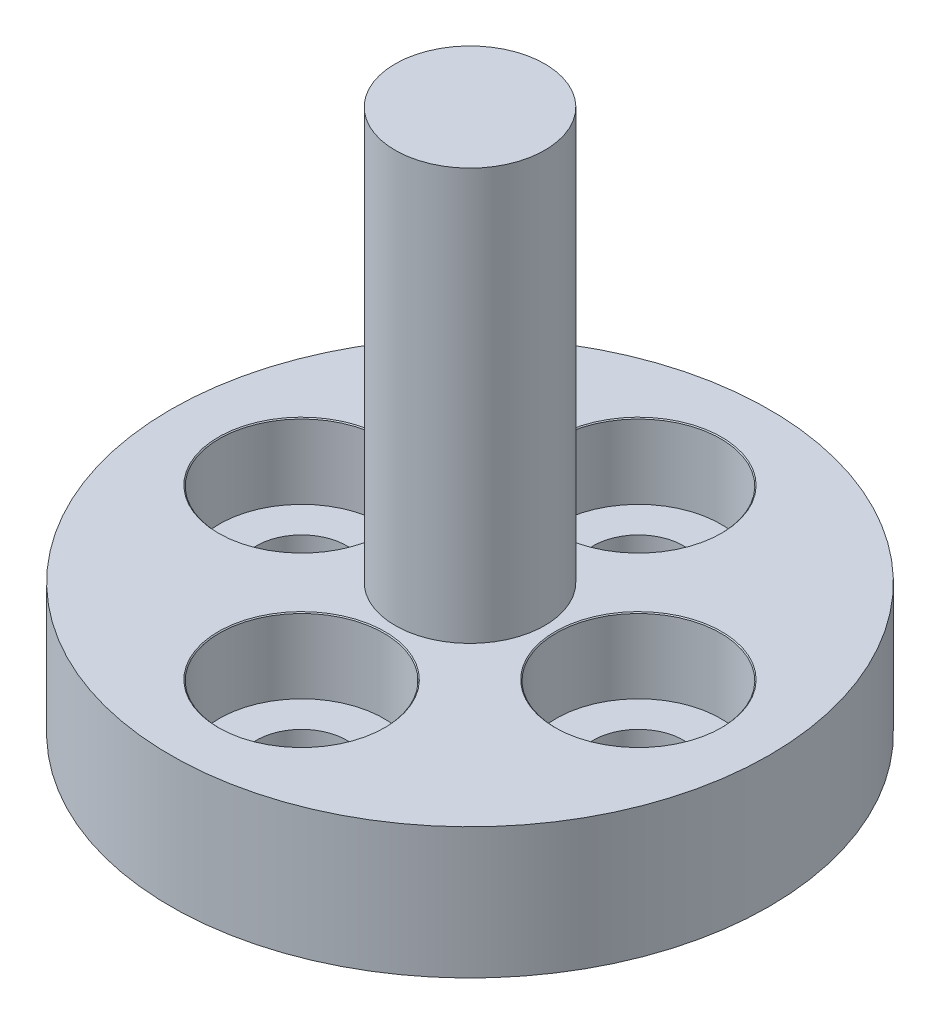
from build123d import *

# Parameters (mm, degrees)
CBORE_FOR_M2_SHCS1_AT_2_COUNT = 2
CBORE_FOR_M2_SHCS1_AT_2_PITCH = 6.363961031
CBORE_FOR_M2_SHCS1_AT_3_COUNT = 2
CBORE_FOR_M2_SHCS1_AT_3_PITCH = 9
CBORE_FOR_M2_SHCS1_AT_4_COUNT = 2
CBORE_FOR_M2_SHCS1_AT_4_PITCH = 6.363961031


with BuildPart() as part:
    # Sketch1 → Revolve1 (revolve)
    with BuildSketch(Plane.XY, mode=Mode.PRIVATE) as revolve1_sk:
        Polygon((0, 0), (8, 0), (8, 3.5), (2, 3.5), (2, 14.5), (0, 14.5), align=None)
    revolve(revolve1_sk.sketch.rotate(Axis((0, 14.5, 0), (0, -1, 0)), 180), axis=Axis((0, 14.5, 0), (0, -1, 0)))

    # Sketch4 → CBORE for M2 SHCS1 (revolve, cut)
    with BuildSketch(Plane(origin=(-4.5, 3.5, 0), x_dir=(0, 0, 1), z_dir=(1, 0, 0))):
        Polygon((0, 0), (0, 3.5), (1.2, 3.5), (1.2, 2), (2.2, 2), (2.2, 0.025), (2.225, 0), align=None)
    cbore_for_m2_shcs1 = revolve(axis=Axis((-4.5, 9.85, 0), (0, -1, 0)), mode=Mode.SUBTRACT)

    # CBORE for M2 SHCS1 at 2: CBORE for M2 SHCS1 ×2
    with Locations(*[Vector(0.7071067811865476, 0, -0.7071067811865476) * (i * CBORE_FOR_M2_SHCS1_AT_2_PITCH) for i in range(1, CBORE_FOR_M2_SHCS1_AT_2_COUNT)]):
        add(cbore_for_m2_shcs1, mode=Mode.SUBTRACT)

    # CBORE for M2 SHCS1 at 3: CBORE for M2 SHCS1 ×2
    with Locations(*[(i * CBORE_FOR_M2_SHCS1_AT_3_PITCH, 0, 0) for i in range(1, CBORE_FOR_M2_SHCS1_AT_3_COUNT)]):
        add(cbore_for_m2_shcs1, mode=Mode.SUBTRACT)

    # CBORE for M2 SHCS1 at 4: CBORE for M2 SHCS1 ×2
    with Locations(*[Vector(0.7071067811865476, 0, 0.7071067811865476) * (i * CBORE_FOR_M2_SHCS1_AT_4_PITCH) for i in range(1, CBORE_FOR_M2_SHCS1_AT_4_COUNT)]):
        add(cbore_for_m2_shcs1, mode=Mode.SUBTRACT)


solid = part.part
